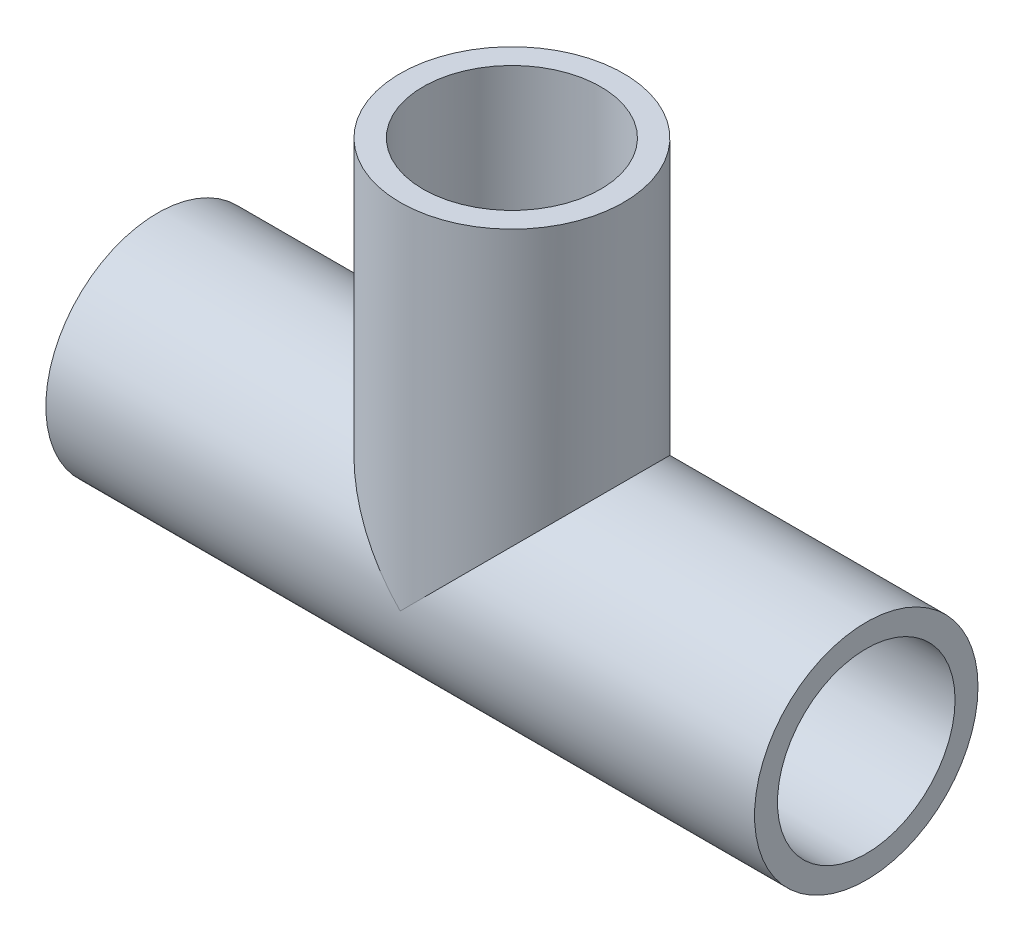
from build123d import *
from build123d.topology import SkipClean

# Parameters (mm, degrees)
CROQUIS1_R              = 13.4
CROQUIS1_R_2            = 10.65
SALIENTE_EXTRUIR1_DEPTH = 85
CROQUIS2_R              = 13.4
CROQUIS2_R_2            = 10.65
SALIENTE_EXTRUIR2_DEPTH = 42.44
CROQUIS3_R              = 10.65
CORTAR_EXTRUIR1_DEPTH   = 84.497438367
CORTAR_EXTRUIR2_START   = -42.497438367
CROQUIS5_R              = 10.65
CORTAR_EXTRUIR2_DEPTH   = 42.497438367


with BuildPart() as part:
    # Croquis1 → Saliente-Extruir1 (new body)
    with BuildSketch(Plane(origin=(0, 0, 0), x_dir=(0, 0, -1), z_dir=(1, 0, 0))):
        Circle(CROQUIS1_R)
        Circle(CROQUIS1_R_2, mode=Mode.SUBTRACT)
    extrude(amount=SALIENTE_EXTRUIR1_DEPTH)

    # Croquis2 → Saliente-Extruir2 (add)
    with BuildSketch(Plane(origin=(0, 0, 0), x_dir=(1, 0, 0), z_dir=(0, 1, 0))):
        with Locations(Location((42.5, 0, 0), (0, 0, 270))):
            Circle(CROQUIS2_R)
        with Locations(Location((42.5, 0, 0), (0, 0, 90))):
            Circle(CROQUIS2_R_2, mode=Mode.SUBTRACT)
    extrude(amount=SALIENTE_EXTRUIR2_DEPTH)

    # Croquis3 → Cortar-Extruir1 (cut)
    with SkipClean():  # the faces are left unmerged after this step: merging them gives an invalid solid
        with BuildSketch(Plane.ZY):
            with Locations(Location((0, 0, 0), (0, 0, 180))):
                Circle(CROQUIS3_R)
        extrude(amount=-CORTAR_EXTRUIR1_DEPTH, mode=Mode.SUBTRACT)

    # Croquis5 → Cortar-Extruir2 (cut)
    with SkipClean():  # the faces are left unmerged after this step: merging them gives an invalid solid
        with BuildSketch(Plane(origin=(0, 42.44, 0), x_dir=(1, 0, 0), z_dir=(0, 1, 0)).offset(CORTAR_EXTRUIR2_START)):
            with Locations(Location((42.5, 0, 0), (0, 0, 270))):
                Circle(CROQUIS5_R)
        extrude(amount=CORTAR_EXTRUIR2_DEPTH, mode=Mode.SUBTRACT)


solid = part.part
